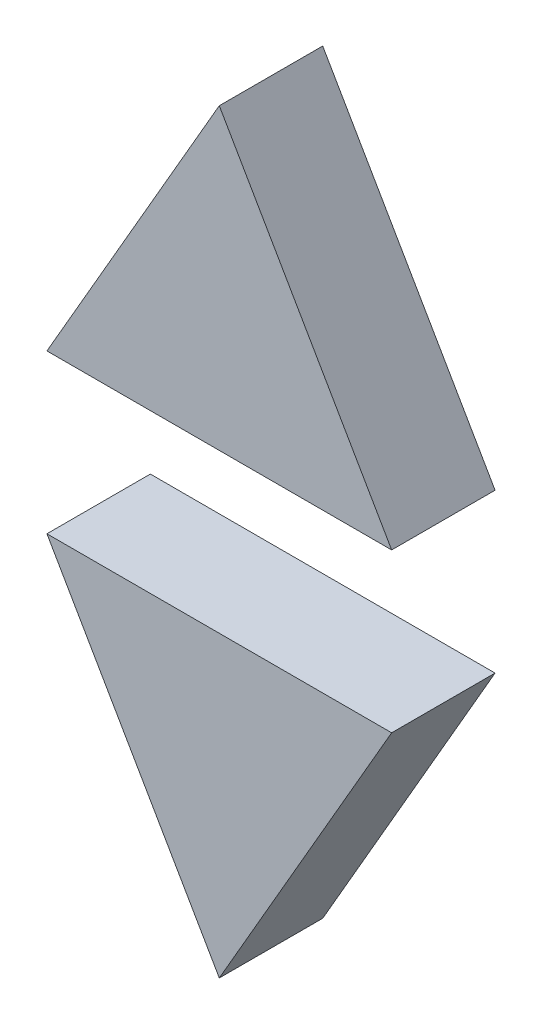
from build123d import *

# Parameters (mm, degrees)
BOSS_EXTRUDE1_DEPTH   = 3
BOSS_EXTRUDE1_2_DEPTH = 3


with BuildPart() as part:
    # Sketch1 → Boss-Extrude1 (new body)
    with BuildSketch(Plane.XY):
        Polygon((18.106270862, 5.181175532), (23.106270862, 13.84142957), (28.106270862, 5.181175532), align=None)
    extrude(amount=BOSS_EXTRUDE1_DEPTH)


with BuildPart() as body_2:
    # Sketch1 → Boss-Extrude1 2 (new body)
    with BuildSketch(Plane.XY):
        Polygon((18.106270862, 0.588179711), (28.106270862, 0.588179711), (23.106270862, -8.072074327), align=None)
    extrude(amount=BOSS_EXTRUDE1_2_DEPTH)


solid = Compound([part.part, body_2.part])
